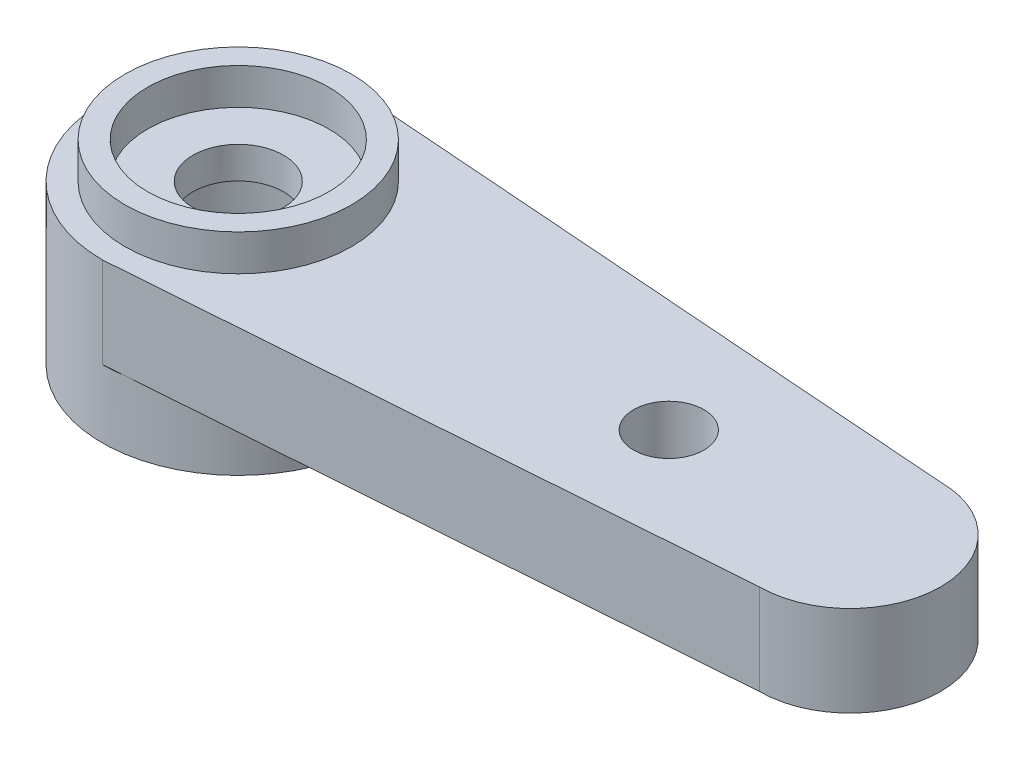
from build123d import *

# Parameters (mm, degrees)
EXTRUDE_1_DEPTH     = 2
SKETCH_3_R          = 2.5
EXTRUDE_2_DEPTH     = 0.8
EXTRUDE_START       = 1.5
SKETCH_4_R          = 3
EXTRUDE_3_DEPTH     = 1.5
SKETCH_5_R          = 2
CUT_EXTRUDE_1_DEPTH = 2.8
CUT_EXTRUDE_START   = -0.8
SKETCH_6_R          = 2
CUT_EXTRUDE_2_DEPTH = 0.8
SKETCH_7_R          = 1
CUT_EXTRUDE_3_DEPTH = 17.170961629
SKETCH_8_R          = 0.775
CUT_EXTRUDE_4_DEPTH = 17.170961629


with BuildPart() as part:
    # Эскиз2 → Бобышка-Вытянуть1 (new body)
    with BuildSketch(Plane(origin=(0, 0, 0), x_dir=(1, 0, 0), z_dir=(0, 1, 0))):
        with BuildLine():
            ThreePointArc((0.4420191, 2.967257844), (2.272229885, 1.958818866), (3, 0))
            Line((3, 0), (11.5, 0))
            ThreePointArc((11.5, 0), (12.085786438, 1.414213562), (13.5, 2))
            Line((13.5, 2), (0.4420191, 2.967257844))
        make_face()
        with BuildLine():
            ThreePointArc((0, 3), (-2.121320344, 2.121320344), (-3, 0))
            Line((-3, 0), (3, 0))
            ThreePointArc((3, 0), (2.272229885, 1.958818866), (0.4420191, 2.967257844))
            Line((0.4420191, 2.967257844), (0, 3))
        make_face()
        with BuildLine():
            Line((3, 0), (-3, 0))
            ThreePointArc((-3, 0), (-2.121320344, -2.121320344), (0, -3))
            Line((0, -3), (0.4420191, -2.967257844))
            ThreePointArc((0.4420191, -2.967257844), (2.272229885, -1.958818866), (3, 0))
        make_face()
        with BuildLine():
            Line((11.5, 0), (3, 0))
            ThreePointArc((3, 0), (2.272229885, -1.958818866), (0.4420191, -2.967257844))
            Line((0.4420191, -2.967257844), (13.5, -2))
            ThreePointArc((13.5, -2), (12.085786438, -1.414213562), (11.5, 0))
        make_face()
        with BuildLine():
            ThreePointArc((13.5, 2), (12.085786438, 1.414213562), (11.5, 0))
            Line((11.5, 0), (15.5, 0))
            ThreePointArc((15.5, 0), (14.914213562, 1.414213562), (13.5, 2))
        make_face()
        with BuildLine():
            Line((15.5, 0), (11.5, 0))
            ThreePointArc((11.5, 0), (12.085786438, -1.414213562), (13.5, -2))
            ThreePointArc((13.5, -2), (14.914213562, -1.414213562), (15.5, 0))
        make_face()
    extrude(amount=EXTRUDE_1_DEPTH)

    # Эскиз3 → Бобышка-Вытянуть2 (add)
    with BuildSketch(Plane(origin=(0, 2, 0), x_dir=(1, 0, 0), z_dir=(0, 1, 0))):
        with Locations(Location((0, 0, 0), (0, 0, 270))):
            Circle(SKETCH_3_R)
    extrude(amount=EXTRUDE_2_DEPTH)

    # Эскиз4 → Бобышка-Вытянуть3 (add)
    with BuildSketch(Plane.XZ.offset(EXTRUDE_START)):
        with Locations(Location((0, 0, 0), (0, 0, 270))):
            Circle(SKETCH_4_R)
    extrude(amount=-EXTRUDE_3_DEPTH)

    # Эскиз5 → Вырез-Вытянуть1 (cut)
    with BuildSketch(Plane(origin=(0, -1.5, 0), x_dir=(-1, 0, 0), z_dir=(0, -1, 0))):
        with Locations(Location((0, 0, 0), (0, 0, 90))):
            Circle(SKETCH_5_R)
    extrude(amount=-CUT_EXTRUDE_1_DEPTH, mode=Mode.SUBTRACT)

    # Эскиз6 → Вырез-Вытянуть2 (cut)
    with BuildSketch(Plane(origin=(0, 2.8, 0), x_dir=(1, 0, 0), z_dir=(0, 1, 0)).offset(CUT_EXTRUDE_START)):
        with Locations(Location((0, 0, 0), (0, 0, 90))):
            Circle(SKETCH_6_R)
    extrude(amount=CUT_EXTRUDE_2_DEPTH, mode=Mode.SUBTRACT)

    # Эскиз7 → Вырез-Вытянуть3 (cut, through all)
    with BuildSketch(Plane(origin=(0, 2, 0), x_dir=(1, 0, 0), z_dir=(0, 1, 0))):
        with Locations(Location((0, 0, 0), (0, 0, 270))):
            Circle(SKETCH_7_R)
    extrude(amount=-CUT_EXTRUDE_3_DEPTH, mode=Mode.SUBTRACT)

    # Эскиз8 → Вырез-Вытянуть4 (cut, through all)
    with BuildSketch(Plane(origin=(0, 2, 0), x_dir=(1, 0, 0), z_dir=(0, 1, 0))):
        with Locations(Location((9.5, 0, 0), (0, 0, 270))):
            Circle(SKETCH_8_R)
    extrude(amount=-CUT_EXTRUDE_4_DEPTH, mode=Mode.SUBTRACT)


solid = part.part
